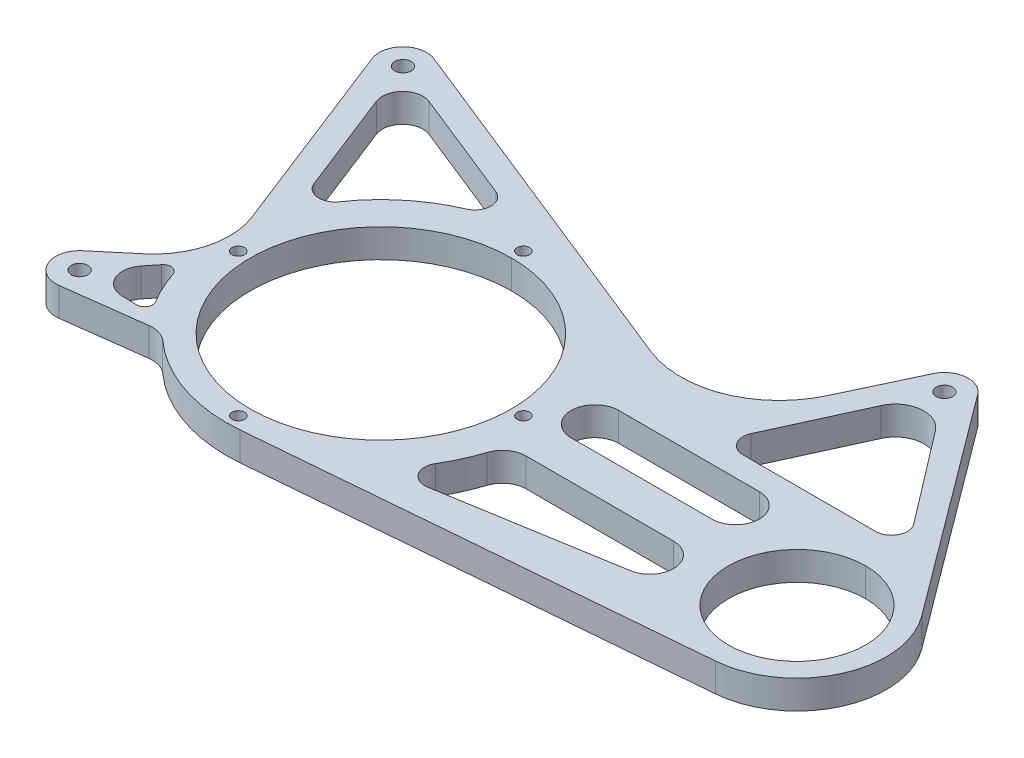
from build123d import *

# Parameters (mm, degrees)
SKETCH1_R             = 52.3875
SKETCH1_R_2           = 27.49999999
BOSS_EXTRUDE1_DEPTH   = 11.43
M6_CLEARANCE_HOLE1_D  = 6.6
F_5_0MM_DOWEL_HOLE1_D = 5
CIRPATTERN1_COUNT     = 4
CUT_EXTRUDE1_DEPTH    = 284.979078357
CUT_EXTRUDE2_DEPTH    = 284.979078357


with BuildPart() as part:
    # Sketch1 → Boss-Extrude1 (new body)
    with BuildSketch(Plane(origin=(0, 0, 0), x_dir=(1, 0, 0), z_dir=(0, 1, 0))):
        with BuildLine():
            Line((-207.974881785, -9.956762437), (-62.780706514, -68.14502812))
            ThreePointArc((-62.780706514, -68.14502812), (-33.518744337, -68.231765471), (-12.176603989, -48.212200061))
            Line((-12.176603989, -48.212200061), (1.412558245, -19.284326264))
            ThreePointArc((1.412558245, -19.284326264), (9.075779399, -13.857488875), (17.670000792, -17.640990049))
            Line((17.670000792, -17.640990049), (83.271163186, -105.631794066))
            ThreePointArc((83.271163186, -105.631794066), (87.219797031, -141.651403947), (57.667100455, -162.619048791))
            Line((57.667100455, -162.619048791), (-117.895657849, -177.687193688))
            ThreePointArc((-117.895657849, -177.687193688), (-142.761859432, -174.739029029), (-164.426538493, -162.182702446))
            ThreePointArc((-164.426538493, -162.182702446), (-168.164823601, -160.06920649), (-172.443362527, -159.700770109))
            Line((-172.443362527, -159.700770109), (-204.355245166, -163.82191268))
            ThreePointArc((-204.355245166, -163.82191268), (-214.295764489, -158.206433226), (-211.707233022, -147.086764223))
            Line((-211.707233022, -147.086764223), (-198.151371623, -135.681934472))
            ThreePointArc((-198.151371623, -135.681934472), (-188.283833694, -119.954004575), (-189.430137427, -101.422354045))
            Line((-189.430137427, -101.422354045), (-220.388836369, -22.267635732))
            ThreePointArc((-220.388836369, -22.267635732), (-218.225236723, -12.034965467), (-207.974881785, -9.956762437))
        make_face()
        with Locations(Location((-123.19, -116.001477372, 0), (0, 0, 270))):
            Circle(SKETCH1_R, mode=Mode.SUBTRACT)
        with Locations(Location((54.61, -127, 0), (0, 0, 270))):
            Circle(SKETCH1_R_2, mode=Mode.SUBTRACT)
    extrude(amount=BOSS_EXTRUDE1_DEPTH)

    # M6 Clearance Hole1 (through all)
    with Locations(Plane(origin=(0, 0, 0), x_dir=(-1, 0, 0), z_dir=(0, -1, 0))):
        with Locations((-10.033704867, -23.334197365), (211.518182886, -18.798178744), (205.575185514, -154.375359311)):
            Hole(M6_CLEARANCE_HOLE1_D / 2)

    # Ø5.0mm Dowel Hole1 (through all)
    with Locations(Plane(origin=(0, 0, 0), x_dir=(-1, 0, 0), z_dir=(0, -1, 0))):
        with Locations((123.19, -173.151477372)):
            f_5_0mm_dowel_hole1 = Hole(F_5_0MM_DOWEL_HOLE1_D / 2)

    # CirPattern1: Ø5.0mm Dowel Hole1 ×4 about axis
    cirpattern1_axis = Axis((-123.19, 0, 116.001477372), (0, 1, 0))
    for i in range(1, CIRPATTERN1_COUNT):
        add(f_5_0mm_dowel_hole1.rotate(cirpattern1_axis, i * 360 / CIRPATTERN1_COUNT), mode=Mode.SUBTRACT)

    # Sketch6 → Cut-Extrude1 (cut, through all)
    with BuildSketch(Plane.XZ):
        with BuildLine():
            Line((-14.234653979, 76.580666612), (2.086502597, 40.770912553))
            ThreePointArc((2.086502597, 40.770912553), (11.250375023, 34.121155358), (21.665234735, 38.562610722))
            Line((21.665234735, 38.562610722), (49.771061223, 75.359760223))
            ThreePointArc((49.771061223, 75.359760223), (50.416714446, 82.029052969), (44.724694776, 85.564197365))
            Line((44.724694776, 85.564197365), (-8.456504121, 85.564197365))
            ThreePointArc((-8.456504121, 85.564197365), (-13.797169823, 82.649279585), (-14.234653979, 76.580666612))
        make_face()
        with BuildLine():
            Line((-204.660650751, 36.331409888), (-188.626913597, 77.326218823))
            ThreePointArc((-188.626913597, 77.326218823), (-183.343464985, 81.400582198), (-177.265672517, 78.648182362))
            ThreePointArc((-177.265672517, 78.648182362), (-164.864290964, 65.181201114), (-149.229324423, 55.657458697))
            ThreePointArc((-149.229324423, 55.657458697), (-145.319075006, 49.625624375), (-149.386073966, 43.698348841))
            Line((-149.386073966, 43.698348841), (-194.042740287, 25.801666969))
            ThreePointArc((-194.042740287, 25.801666969), (-202.810079512, 27.579196728), (-204.660650751, 36.331409888))
        make_face()
        with BuildLine():
            Line((-190.985681304, 136.027573744), (-194.692687992, 140.689511725))
            ThreePointArc((-194.692687992, 140.689511725), (-195.773357295, 149.809803058), (-188.096484537, 154.850952212))
            Line((-188.096484537, 154.850952212), (-182.142551509, 155.01295786))
            ThreePointArc((-182.142551509, 155.01295786), (-179.298484939, 153.425933155), (-179.332786017, 150.169219243))
            ThreePointArc((-179.332786017, 150.169219243), (-182.766707481, 143.751485155), (-185.46990532, 136.993390091))
            ThreePointArc((-185.46990532, 136.993390091), (-187.940827525, 134.871620657), (-190.985681304, 136.027573744))
        make_face()
    extrude(amount=-CUT_EXTRUDE1_DEPTH, mode=Mode.SUBTRACT)

    # Sketch7 → Cut-Extrude2 (cut, through all)
    with BuildSketch(Plane.XZ):
        with BuildLine():
            Line((-48.815667356, 114.096477372), (7.572332644, 114.096477372))
            ThreePointArc((7.572332644, 114.096477372), (17.097332644, 104.571477372), (7.572332644, 95.046477372))
            Line((7.572332644, 95.046477372), (-48.815667356, 95.046477372))
            ThreePointArc((-48.815667356, 95.046477372), (-58.340667356, 104.571477372), (-48.815667356, 114.096477372))
        make_face()
        with BuildLine():
            Line((-60.480063265, 159.980626251), (9.143311078, 148.338049571))
            ThreePointArc((9.143311078, 148.338049571), (17.064665217, 138.155302762), (7.572332644, 129.418495204))
            Line((7.572332644, 129.418495204), (-51.525154545, 129.418495204))
            ThreePointArc((-51.525154545, 129.418495204), (-57.140513894, 131.249772802), (-60.59665397, 136.039442314))
            ThreePointArc((-60.59665397, 136.039442314), (-63.415414116, 143.322639291), (-67.078188304, 150.220062883))
            ThreePointArc((-67.078188304, 150.220062883), (-66.914295931, 157.219714512), (-60.480063265, 159.980626251))
        make_face()
    extrude(amount=-CUT_EXTRUDE2_DEPTH, mode=Mode.SUBTRACT)


solid = part.part
